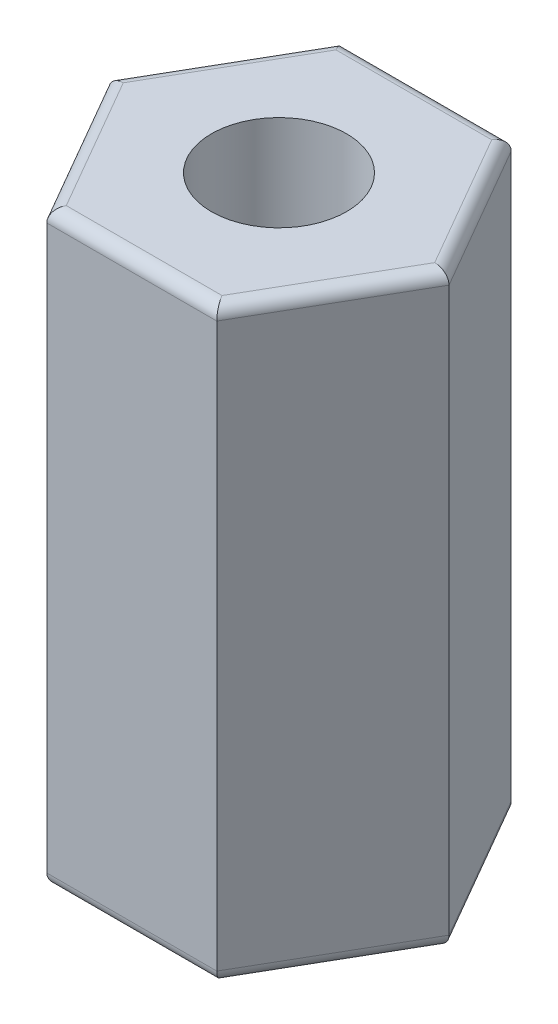
from build123d import *

# Parameters (mm, degrees)
RESSALTO_EXTRUS_O1_DEPTH = 9.5
FILETE1_R                = 0.2
ESBO_O3_R                = 1.0922
CORTE_EXTRUS_O1_DEPTH    = 4.76
ESBO_O2_R                = 1.0922
CORTE_EXTRUS_O2_DEPTH    = 11.171869707


with BuildPart() as part:
    # Esboço1 → Ressalto-extrusão1 (new body)
    with BuildSketch(Plane(origin=(0, 0, 0), x_dir=(1, 0, 0), z_dir=(0, 1, 0))):
        Polygon((2.748187281, 0), (1.374093641, 2.38), (-1.374093641, 2.38), (-2.748187281, 0), (-1.374093641, -2.38), (1.374093641, -2.38), align=None)
    extrude(amount=RESSALTO_EXTRUS_O1_DEPTH)

    # Filete1
    filete1_edges = [part.edges().sort_by_distance(p)[0] for p in [
        (0, 9.5, -2.38),
        (-2.061140461, 9.5, -1.19),
        (-2.061140461, 9.5, 1.19),
        (0, 9.5, 2.38),
        (2.061140461, 9.5, 1.19),
        (0, 0, 2.38),
        (-2.061140461, 0, 1.19),
        (-2.061140461, 0, -1.19),
        (2.061140461, 9.5, -1.19),
        (0, 0, -2.38),
        (2.061140461, 0, -1.19),
        (2.061140461, 0, 1.19),
    ]]
    fillet(filete1_edges, radius=FILETE1_R)

    # Esboço3 → Corte-extrusão1 (cut)
    with BuildSketch(Plane(origin=(0, 9.5, 0), x_dir=(1, 0, 0), z_dir=(0, 1, 0))):
        with Locations(Location((0, 0, 0), (0, 0, 270))):
            Circle(ESBO_O3_R)
    extrude(amount=-CORTE_EXTRUS_O1_DEPTH, mode=Mode.SUBTRACT)

    # Esboço2 → Corte-extrusão2 (cut, through all)
    with BuildSketch(Plane.XZ):
        with Locations(Location((0, 0, 0), (0, 0, 90))):
            Circle(ESBO_O2_R)
    extrude(amount=-CORTE_EXTRUS_O2_DEPTH, mode=Mode.SUBTRACT)


solid = part.part
